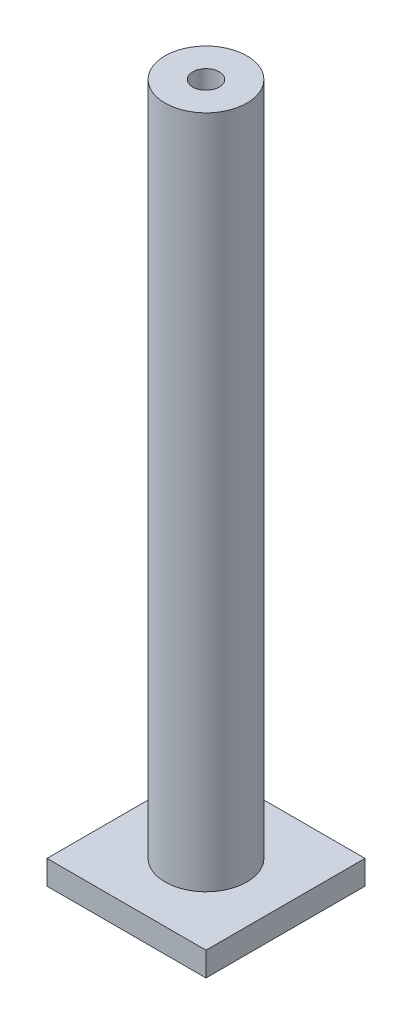
from build123d import *

# Parameters (mm, degrees)
SKETCH1_W           = 16.5
SKETCH1_H           = 16.5
SKETCH1_R           = 1.375
BOSS_EXTRUDE1_DEPTH = 2.5
SKETCH2_R           = 4.25
SKETCH2_R_2         = 1.375
BOSS_EXTRUDE2_DEPTH = 70


with BuildPart() as part:
    # Sketch1 → Boss-Extrude1 (new body)
    with BuildSketch(Plane(origin=(0, 0, 0), x_dir=(1, 0, 0), z_dir=(0, 1, 0))):
        with Locations((0.455521472, -1.417177914)):
            Rectangle(SKETCH1_W, SKETCH1_H)
        with Locations(Location((0.455521472, -1.417177914, 0), (0, 0, 270))):
            Circle(SKETCH1_R, mode=Mode.SUBTRACT)
    extrude(amount=BOSS_EXTRUDE1_DEPTH)

    # Sketch2 → Boss-Extrude2 (add)
    with BuildSketch(Plane(origin=(0, 2.5, 0), x_dir=(1, 0, 0), z_dir=(0, 1, 0))):
        with Locations(Location((0.455521472, -1.417177914, 0), (0, 0, 270))):
            Circle(SKETCH2_R)
        with Locations(Location((0.455521472, -1.417177914, 0), (0, 0, 270))):
            Circle(SKETCH2_R_2, mode=Mode.SUBTRACT)
    extrude(amount=BOSS_EXTRUDE2_DEPTH)


solid = part.part
